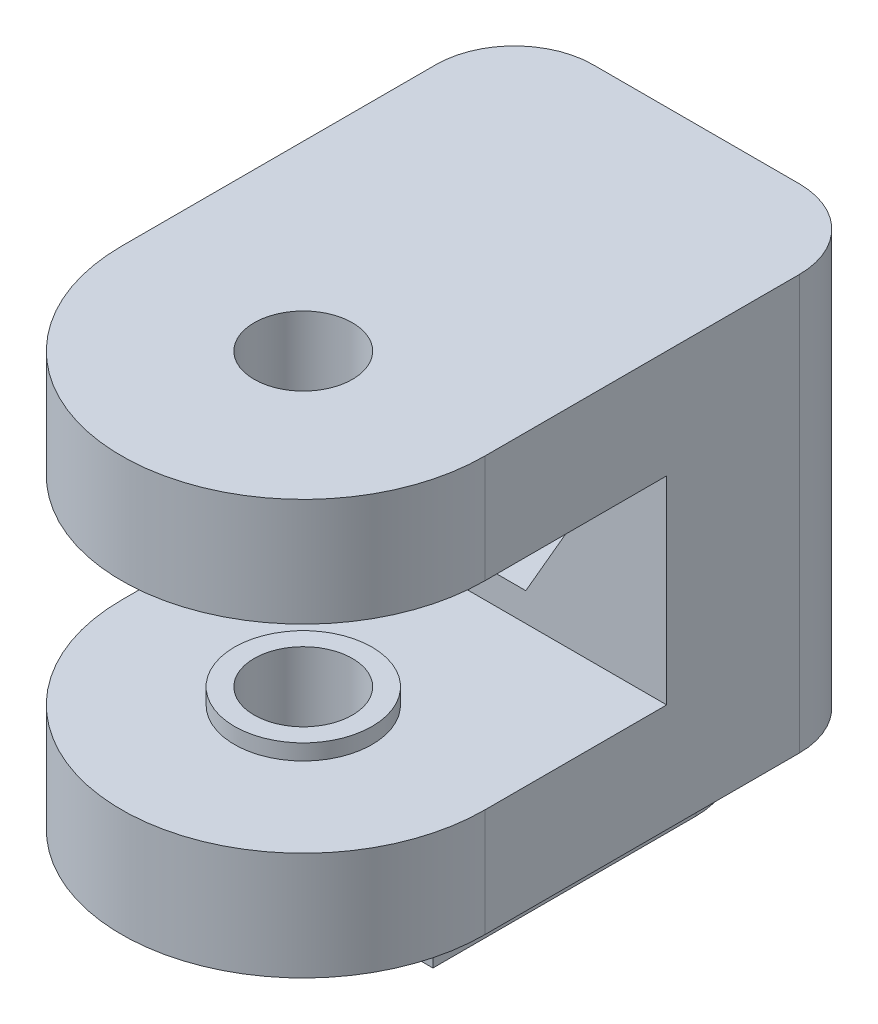
from build123d import *

# Parameters (mm, degrees)
SKETCH1_R           = 2.5
BOSS_EXTRUDE1_DEPTH = 21.1
SKETCH2_W           = 18.5
SKETCH2_H           = 10.1
CUT_EXTRUDE1_DEPTH  = 35.459541494
BOSS_EXTRUDE3_DEPTH = 5.3
SKETCH4_R           = 3.5
SKETCH4_R_2         = 2.5
BOSS_EXTRUDE4_DEPTH = 0.8
FILLET1_R           = 4
CUT_EXTRUDE2_DEPTH  = 7
SKETCH6_R           = 2.2
CUT_EXTRUDE3_DEPTH  = 7


with BuildPart() as part:
    # Sketch1 → Boss-Extrude1 (new body)
    with BuildSketch(Plane(origin=(0, 0, 0), x_dir=(1, 0, 0), z_dir=(0, 1, 0))):
        with BuildLine():
            Line((-9.25, 0), (-9.25, 20))
            Line((-9.25, 20), (9.25, 20))
            Line((9.25, 20), (9.25, 0))
            ThreePointArc((9.25, 0), (0, -9.25), (-9.25, 0))
        make_face()
        with Locations(Location((0, 0, 0), (0, 0, 270))):
            Circle(SKETCH1_R, mode=Mode.SUBTRACT)
    extrude(amount=BOSS_EXTRUDE1_DEPTH)

    # Sketch2 → Cut-Extrude1 (cut, through all)
    with BuildSketch(Plane(origin=(9.25, 0, 0), x_dir=(0, 0, -1), z_dir=(1, 0, 0))):
        with Locations((0, 10.55)):
            Rectangle(SKETCH2_W, SKETCH2_H)
    extrude(amount=-CUT_EXTRUDE1_DEPTH, mode=Mode.SUBTRACT)

    # Sketch3 → Boss-Extrude3 (add)
    with BuildSketch(Plane.XZ):
        with BuildLine():
            Line((4.1, -2.5), (4.1, -15.9))
            ThreePointArc((4.1, -15.9), (0, -20), (-4.1, -15.9))
            Line((-4.1, -15.9), (-4.1, -2.5))
            Line((-4.1, -2.5), (-3.249615362, -2.5))
            ThreePointArc((-3.249615362, -2.5), (0, -4.1), (3.249615362, -2.5))
            Line((3.249615362, -2.5), (4.1, -2.5))
        make_face()
    extrude(amount=BOSS_EXTRUDE3_DEPTH)

    # Sketch4 → Boss-Extrude4 (add)
    with BuildSketch(Plane(origin=(0, 5.5, 0), x_dir=(1, 0, 0), z_dir=(0, 1, 0))):
        with Locations(Location((0, 0, 0), (0, 0, 90))):
            Circle(SKETCH4_R)
        with Locations(Location((0, 0, 0), (0, 0, 270))):
            Circle(SKETCH4_R_2, mode=Mode.SUBTRACT)
    boss_extrude4 = extrude(amount=BOSS_EXTRUDE4_DEPTH)

    # Mirror1: Boss-Extrude4 across plane
    add(boss_extrude4.mirror(Plane.ZX.offset(10.55)))

    # Fillet1
    fillet1_edges = [part.edges().sort_by_distance(p)[0] for p in [
        (-9.25, 10.55, -20),
        (9.25, 10.55, -20),
    ]]
    fillet(fillet1_edges, radius=FILLET1_R)

    # Sketch5 → Cut-Extrude2 (cut)
    with BuildSketch(Plane.XY.offset(-9.25)):
        Polygon((2.078460969, 6.95), (4.156921938, 10.55), (2.078460969, 14.15), (-2.078460969, 14.15), (-4.156921938, 10.55), (-2.078460969, 6.95), align=None)
    extrude(amount=-CUT_EXTRUDE2_DEPTH, mode=Mode.SUBTRACT)

    # Sketch6 → Cut-Extrude3 (cut)
    with BuildSketch(Plane.XY.offset(-16.25)):
        with Locations((0, 10.55)):
            Circle(SKETCH6_R)
    extrude(amount=-CUT_EXTRUDE3_DEPTH, mode=Mode.SUBTRACT)


solid = part.part
